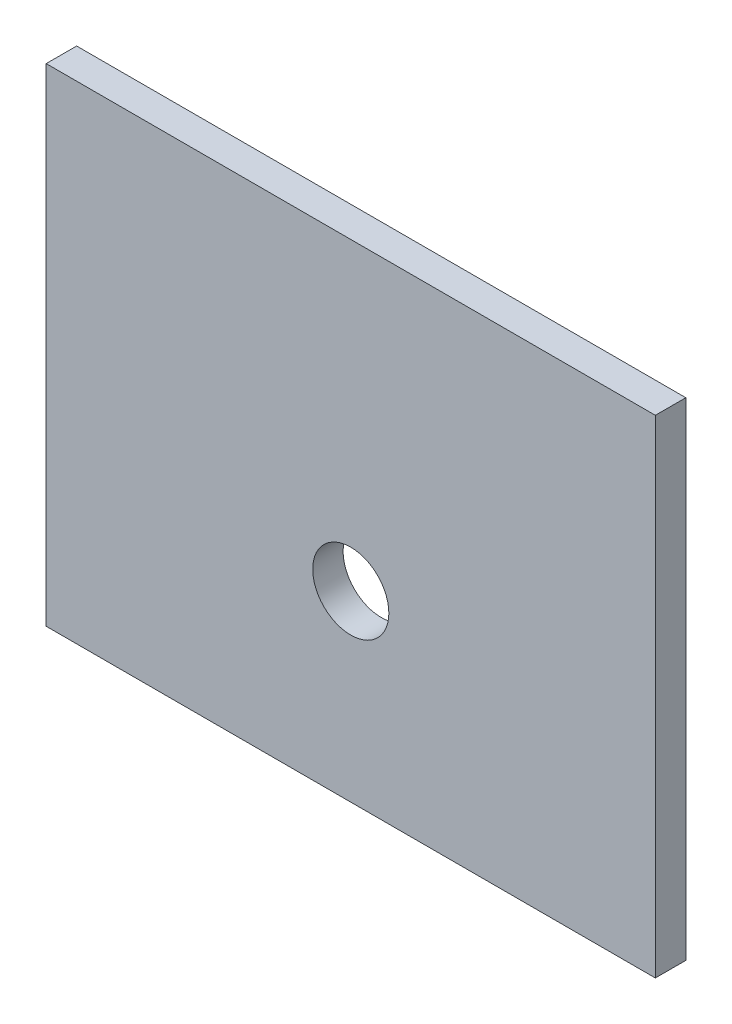
from build123d import *

# Parameters (mm, degrees)
SKETCH1_W           = 63.5
SKETCH1_H           = 50.8
SKETCH1_R           = 3.96875
BOSS_EXTRUDE1_DEPTH = 3.175


with BuildPart() as part:
    # Sketch1 → Boss-Extrude1 (new body)
    with BuildSketch(Plane.XY):
        Rectangle(SKETCH1_W, SKETCH1_H)
        with Locations((0, -6.35)):
            Circle(SKETCH1_R, mode=Mode.SUBTRACT)
    extrude(amount=BOSS_EXTRUDE1_DEPTH)


solid = part.part
